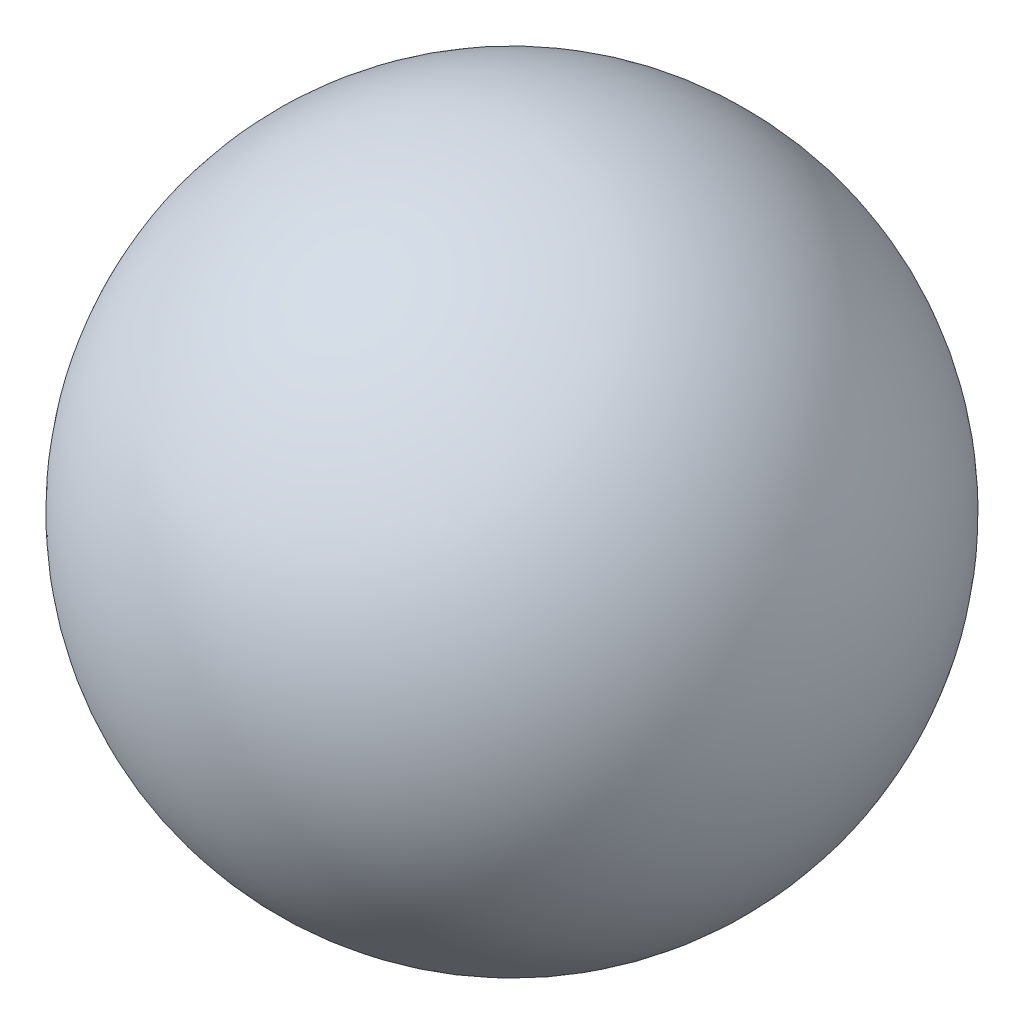
from build123d import *


with BuildPart() as part:
    # Sketch1 → Revolução1 (revolve)
    with BuildSketch(Plane.XY):
        with BuildLine():
            Line((3.6905, 9.75), (1.3095, 9.75))
            ThreePointArc((1.3095, 9.75), (2.5, 10.9405), (3.6905, 9.75))
        make_face()
    revolve(axis=Axis((3.6905, 9.75, 0), (-1, 0, 0)))


solid = part.part
